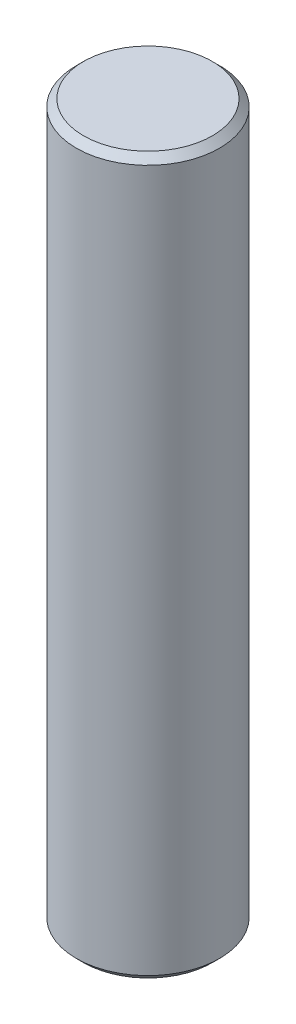
from build123d import *

# Parameters (mm, degrees)
SKETCH1_R           = 2.499995
BOSS_EXTRUDE1_DEPTH = 25
CHAMFER1_SIZE       = 0.25


with BuildPart() as part:
    # Sketch1 → Boss-Extrude1 (new body)
    with BuildSketch(Plane(origin=(0, 0, 0), x_dir=(1, 0, 0), z_dir=(0, 1, 0))):
        with Locations(Location((0, 0, 0), (0, 0, 270))):
            Circle(SKETCH1_R)
    extrude(amount=BOSS_EXTRUDE1_DEPTH)

    # Chamfer1
    chamfer1_edges = [part.edges().sort_by_distance(p)[0] for p in [
        (0, 0, -2.499995),
        (0, 25, -2.499995),
    ]]
    chamfer(chamfer1_edges, length=CHAMFER1_SIZE)


solid = part.part
